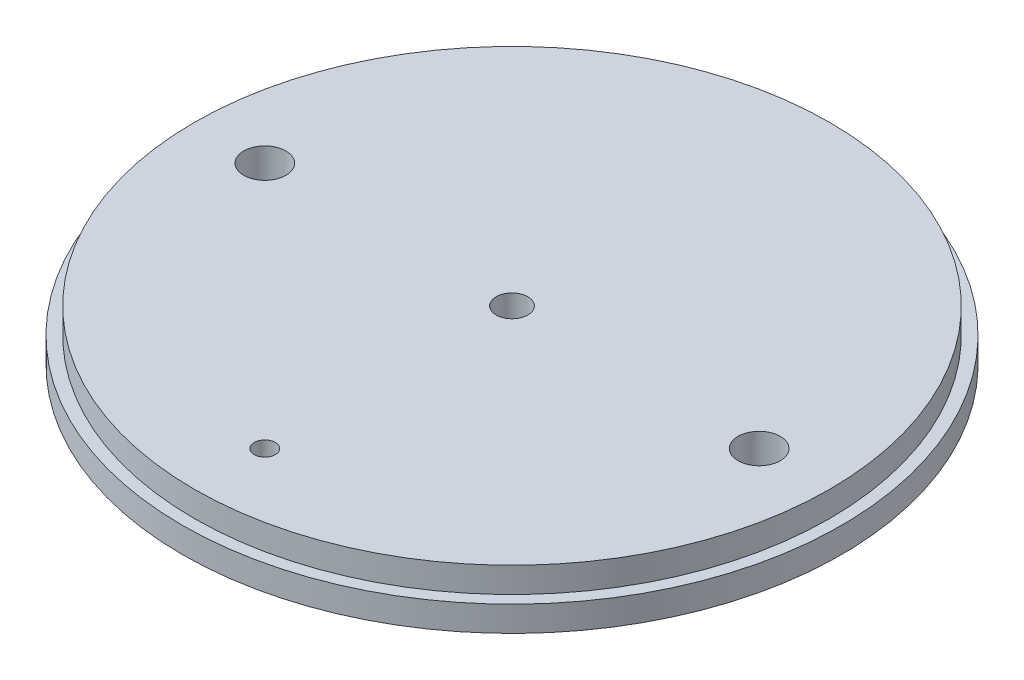
from build123d import *

# Parameters (mm, degrees)
SKETCH2_R           = 49.53
BOSS_EXTRUDE1_DEPTH = 3.81
SKETCH3_R           = 47.752
BOSS_EXTRUDE2_DEPTH = 3.81
SKETCH5_R           = 3.175
SKETCH5_R_2         = 1.5875
SKETCH5_R_3         = 2.38125
CUT_EXTRUDE1_DEPTH  = 17.526


with BuildPart() as part:
    # Sketch2 → Boss-Extrude1 (new body)
    with BuildSketch(Plane(origin=(0, 0, 0), x_dir=(1, 0, 0), z_dir=(0, 1, 0))):
        with Locations(Location((0, 0, 0), (0, 0, 90))):
            Circle(SKETCH2_R)
    extrude(amount=BOSS_EXTRUDE1_DEPTH)

    # Sketch3 → Boss-Extrude2 (add)
    with BuildSketch(Plane(origin=(0, 3.81, 0), x_dir=(1, 0, 0), z_dir=(0, 1, 0))):
        with Locations(Location((0, 0, 0), (0, 0, 90))):
            Circle(SKETCH3_R)
    extrude(amount=BOSS_EXTRUDE2_DEPTH)

    # Sketch5 → Cut-Extrude1 (cut)
    with BuildSketch(Plane.XZ):
        with Locations(Location((37.1475, 0, 0), (0, 0, 270))):
            Circle(SKETCH5_R)
        with Locations(Location((-37.1475, 0, 0), (0, 0, 270))):
            Circle(SKETCH5_R)
        with Locations(Location((0, 37.1475, 0), (0, 0, 270))):
            Circle(SKETCH5_R_2)
        with Locations(Location((0, 0, 0), (0, 0, 270))):
            Circle(SKETCH5_R_3)
    extrude(amount=-CUT_EXTRUDE1_DEPTH, mode=Mode.SUBTRACT)


solid = part.part
